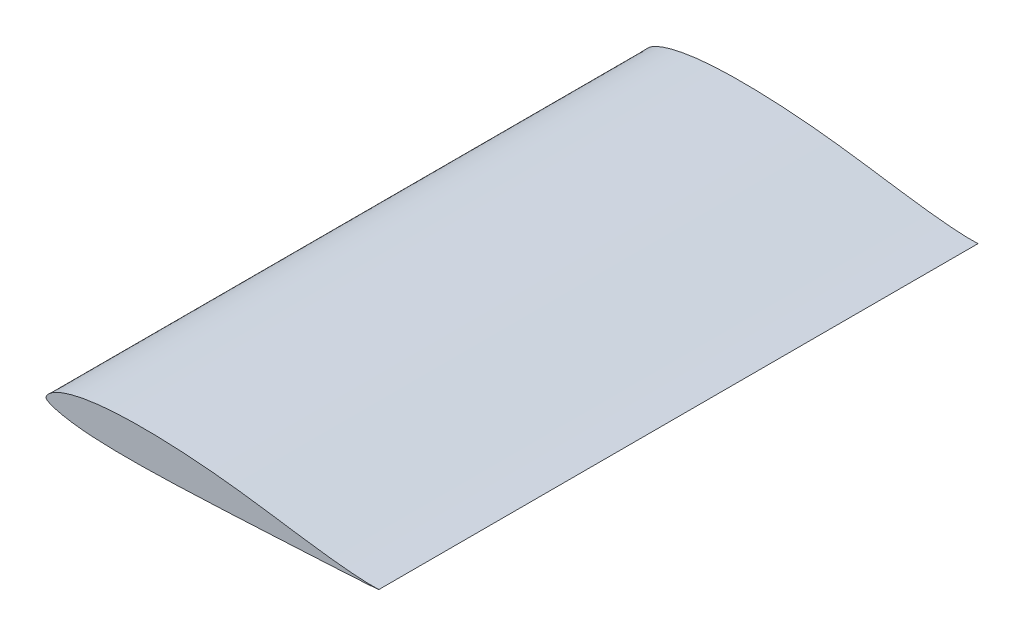
from build123d import *

# Parameters (mm, degrees)
BOSS_EXTRUDE4_DEPTH = 180


with BuildPart() as part:
    # Sketch1 → Boss-Extrude4 (new body)
    with BuildSketch(Plane.XY):
        with BuildLine():
            add(Edge.make_bspline(
                [(69.735876, -1.793852), (70.608089495, -1.747932856), (72.328567865, -1.657157161), (74.87039562, -1.522399053), (77.331621942, -1.391057096), (79.703666164, -1.263805995), (81.978202217, -1.141165174), (84.147216981, -1.023494921), (86.203039567, -0.911063378), (88.138265493, -0.804543604), (89.945764271, -0.70429925), (91.618871177, -0.609949109), (93.151522849, -0.52131094), (94.538172572, -0.438608234), (95.773689591, -0.361621236), (96.853498673, -0.289800896), (97.774413131, -0.222674937), (98.53552651, -0.157271029), (99.136779464, -0.094075476), (99.607091448, -0.039902252), (99.877307496, -0.011019959), (100, 0)],
                knots=[0.313502998, 0.313502998, 0.313502998, 0.313502998, 0.372831171, 0.430531061, 0.4864021, 0.540250729, 0.591886628, 0.64112705, 0.687800246, 0.73173946, 0.772778517, 0.810765388, 0.845567742, 0.877059592, 0.905122506, 0.929654295, 0.950568661, 0.967841974, 0.981541611, 0.991632594, 1, 1, 1, 1], degree=3))
            add(Edge.make_bspline(
                [(100, 0), (99.873129742, -0.00712635), (99.585898659, -0.022012633), (99.072304894, -0.041690826), (98.394963832, -0.054005184), (97.526411895, -0.048417603), (96.474293115, -0.02034681), (95.246588694, 0.031416183), (93.850554578, 0.109574323), (92.29343803, 0.2164812), (90.583961975, 0.35528105), (88.733418439, 0.530991147), (86.754452732, 0.743867583), (84.65927894, 0.989937128), (82.45926313, 1.266413674), (80.165437657, 1.57077848), (77.788956573, 1.899452982), (75.341214818, 2.24895922), (72.832884436, 2.613908423), (70.273915216, 2.987995295), (67.674566561, 3.367102289), (65.045269664, 3.746955809), (62.393071275, 4.117010117), (59.722232244, 4.46614481), (57.039112499, 4.798100851), (54.351072114, 5.112136436), (51.66383152, 5.398590945), (48.981561614, 5.652637158), (46.310078574, 5.879637947), (43.6565668, 6.080144787), (41.028212232, 6.249471892), (38.431707606, 6.387198611), (35.874409843, 6.49565307), (33.363871603, 6.573706835), (30.907004288, 6.617956989), (28.510356503, 6.62885009), (26.181023375, 6.60840813), (23.92523292, 6.553847182), (21.747720331, 6.459717108), (19.652551646, 6.330440774), (17.644759413, 6.169632847), (15.729596629, 5.974772022), (13.910922244, 5.743316106), (12.191601702, 5.48103748), (10.575421552, 5.191591379), (9.066748534, 4.87341841), (7.668542703, 4.527016928), (6.382699099, 4.158720881), (5.211668409, 3.771357932), (4.158439081, 3.361660847), (3.222924968, 2.933103573), (2.403124254, 2.495803712), (1.700146511, 2.054919073), (1.117123919, 1.611344389), (0.654431198, 1.174406648), (0.3053692, 0.755795207), (0.087632071, 0.371336729), (-0.037535917, 0.010623486), (0.083427797, -0.347444654), (0.421891675, -0.608211672), (0.874203128, -0.888229469), (1.485449923, -1.165340334), (2.236751368, -1.441888353), (3.130706333, -1.708788866), (4.161629866, -1.966827661), (5.326736835, -2.21279833), (6.622524232, -2.442923652), (8.045630214, -2.65465652), (9.591691021, -2.848039001), (11.256952298, -3.01996713), (13.038706849, -3.165180523), (14.933887417, -3.284403748), (16.937945288, -3.381130263), (19.045951274, -3.453588966), (21.253541626, -3.498173846), (23.556044841, -3.518849278), (25.947318862, -3.519478421), (28.42013569, -3.499787898), (30.96743447, -3.45954231), (33.581913433, -3.401941951), (36.255485469, -3.329439944), (38.979699334, -3.241952541), (41.746385993, -3.140467513), (44.547127441, -3.027950344), (47.372809363, -2.906756913), (50.213835209, -2.778002608), (53.060644775, -2.643444461), (54.959331076, -2.550713869), (55.908049, -2.503829)],
                knots=[0, 0, 0, 0, 0.002209239, 0.005000407, 0.008935479, 0.013986294, 0.020099911, 0.027233162, 0.035349325, 0.044408582, 0.054368153, 0.065167122, 0.076725742, 0.088972112, 0.101843596, 0.115275579, 0.129201713, 0.14355407, 0.158263417, 0.173270549, 0.188517037, 0.203933657, 0.219457904, 0.235074265, 0.250763231, 0.266461846, 0.282125694, 0.297747091, 0.313303395, 0.328738699, 0.344011606, 0.359093532, 0.373943939, 0.388511763, 0.402761603, 0.416664517, 0.43017895, 0.443259533, 0.455893011, 0.468070085, 0.479753341, 0.490909964, 0.501535741, 0.511624327, 0.521144712, 0.530077941, 0.538426036, 0.546183426, 0.553327175, 0.55986305, 0.56582104, 0.571206958, 0.576005951, 0.580233938, 0.583918525, 0.587059665, 0.58964722, 0.591628454, 0.593459553, 0.595772042, 0.59887573, 0.602752548, 0.607392103, 0.61279644, 0.618960666, 0.625865321, 0.633494769, 0.64183835, 0.650876949, 0.66058182, 0.67094208, 0.681954964, 0.693595004, 0.705823986, 0.718625022, 0.731982781, 0.745856178, 0.760199101, 0.774975913, 0.790148519, 0.805665087, 0.821475377, 0.837535771, 0.853798758, 0.870208112, 0.886708024, 0.903243327, 0.91975781, 0.91975781, 0.91975781, 0.91975781], degree=3))
            add(Edge.make_bspline(
                [(55.908049, -2.503829), (56.852283689, -2.457165689), (58.732861507, -2.363143709), (61.538485117, -2.220500373), (65.203593692, -2.031812793), (67.932271926, -1.888805483), (69.735876, -1.793852)],
                knots=[0.91975781, 0.91975781, 0.91975781, 0.91975781, 0.936194252, 0.952494259, 0.968599217, 1, 1, 1, 1], degree=3))
        make_face()
    extrude(amount=BOSS_EXTRUDE4_DEPTH)


solid = part.part
